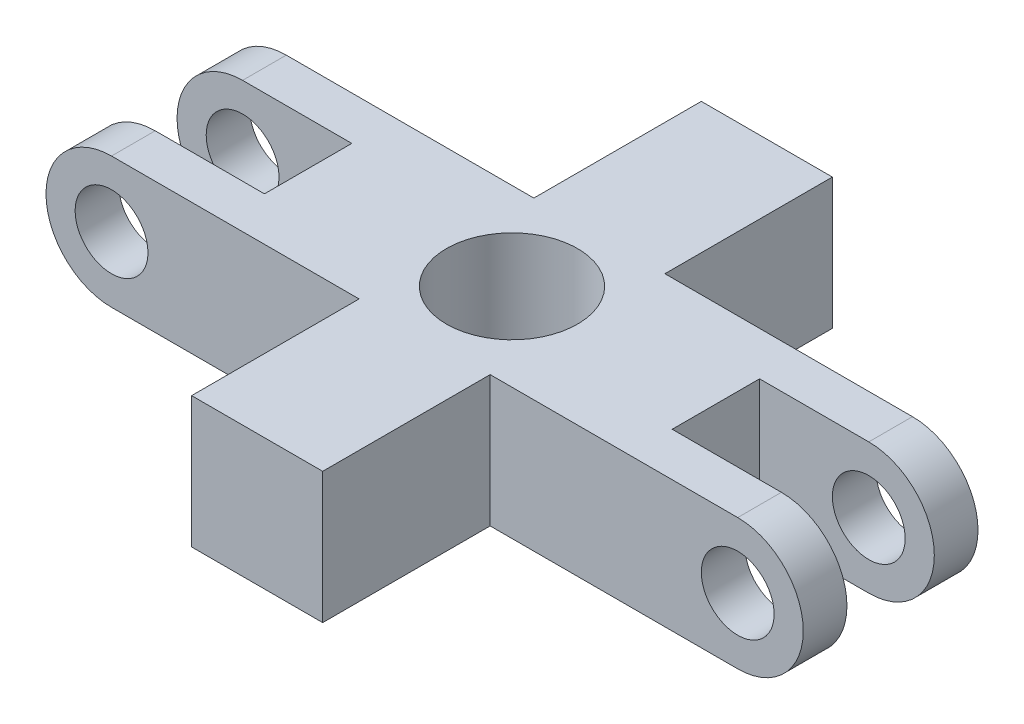
from build123d import *

# Parameters (mm, degrees)
SKETCH1_R           = 4.5
BOSS_EXTRUDE1_DEPTH = 4.5
FILLET2_RADIUS      = 4.5
FILLET2_LENGTH      = 3
FILLET3_RADIUS      = 4.5
FILLET3_LENGTH      = 3
FILLET4_RADIUS      = 4.5
FILLET4_LENGTH      = 3
FILLET5_RADIUS      = 4.5
FILLET5_LENGTH      = 3
SKETCH2_R           = 2.5
CUT_EXTRUDE1_DEPTH  = 34.414068893


with BuildPart() as part:
    # Sketch1 → Boss-Extrude1 (new, symmetric)
    with BuildSketch(Plane(origin=(0, 0, 0), x_dir=(1, 0, 0), z_dir=(0, 1, 0))):
        Polygon((-26, 3), (-14, 3), (-14, -3), (-26, -3), (-26, -6), (-4.5, -6), (-4.5, -17.5), (4.5, -17.5), (4.5, -6), (26, -6), (26, -3), (14, -3), (14, 3), (26, 3), (26, 6), (4.5, 6), (4.5, 17.5), (-4.5, 17.5), (-4.5, 6), (-26, 6), align=None)
        with Locations(Location((0, 0, 0), (0, 0, 270))):
            Circle(SKETCH1_R, mode=Mode.SUBTRACT)
    extrude(amount=BOSS_EXTRUDE1_DEPTH, both=True)

    # Fillet2: full round fillet: the end face becomes a half cylinder, R = half its width
    fillet2_face = Plane((-26, 0, 4.5), x_dir=(0, 0, 1), z_dir=(-1, 0, 0))  # on the end face: x along it, z out of the body
    fillet2_slab = fillet2_face.offset(-FILLET2_RADIUS / 2) * Box(FILLET2_LENGTH, 2 * FILLET2_RADIUS, FILLET2_RADIUS, mode=Mode.PRIVATE)  # the body's end, R deep
    fillet2_round = Plane((-21.5, 0, 4.5), x_dir=(-1, 0, 0), z_dir=(0, 0, 1)) * Cylinder(FILLET2_RADIUS, FILLET2_LENGTH, mode=Mode.PRIVATE)  # its axis R under the face
    add(fillet2_slab - fillet2_round, mode=Mode.SUBTRACT)

    # Fillet3: full round fillet: the end face becomes a half cylinder, R = half its width
    fillet3_face = Plane((-26, 0, -4.5), x_dir=(0, 0, 1), z_dir=(-1, 0, 0))  # on the end face: x along it, z out of the body
    fillet3_slab = fillet3_face.offset(-FILLET3_RADIUS / 2) * Box(FILLET3_LENGTH, 2 * FILLET3_RADIUS, FILLET3_RADIUS, mode=Mode.PRIVATE)  # the body's end, R deep
    fillet3_round = Plane((-21.5, 0, -4.5), x_dir=(-1, 0, 0), z_dir=(0, 0, 1)) * Cylinder(FILLET3_RADIUS, FILLET3_LENGTH, mode=Mode.PRIVATE)  # its axis R under the face
    add(fillet3_slab - fillet3_round, mode=Mode.SUBTRACT)

    # Fillet4: full round fillet: the end face becomes a half cylinder, R = half its width
    fillet4_face = Plane((26, 0, -4.5), x_dir=(0, 0, 1), z_dir=(1, 0, 0))  # on the end face: x along it, z out of the body
    fillet4_slab = fillet4_face.offset(-FILLET4_RADIUS / 2) * Box(FILLET4_LENGTH, 2 * FILLET4_RADIUS, FILLET4_RADIUS, mode=Mode.PRIVATE)  # the body's end, R deep
    fillet4_round = Plane((21.5, 0, -4.5), x_dir=(1, 0, 0), z_dir=(0, 0, 1)) * Cylinder(FILLET4_RADIUS, FILLET4_LENGTH, mode=Mode.PRIVATE)  # its axis R under the face
    add(fillet4_slab - fillet4_round, mode=Mode.SUBTRACT)

    # Fillet5: full round fillet: the end face becomes a half cylinder, R = half its width
    fillet5_face = Plane((26, 0, 4.5), x_dir=(0, 0, -1), z_dir=(1, 0, 0))  # on the end face: x along it, z out of the body
    fillet5_slab = fillet5_face.offset(-FILLET5_RADIUS / 2) * Box(FILLET5_LENGTH, 2 * FILLET5_RADIUS, FILLET5_RADIUS, mode=Mode.PRIVATE)  # the body's end, R deep
    fillet5_round = Plane((21.5, 0, 4.5), x_dir=(1, 0, 0), z_dir=(0, 0, -1)) * Cylinder(FILLET5_RADIUS, FILLET5_LENGTH, mode=Mode.PRIVATE)  # its axis R under the face
    add(fillet5_slab - fillet5_round, mode=Mode.SUBTRACT)

    # Sketch2 → Cut-Extrude1 (cut, symmetric)
    with BuildSketch(Plane.XY.offset(-3)):
        with Locations(Location((-21.5, 0, 0), (0, 0, 180))):
            Circle(SKETCH2_R)
    cut_extrude1 = extrude(amount=CUT_EXTRUDE1_DEPTH, both=True, mode=Mode.SUBTRACT)

    # Mirror1: Cut-Extrude1 across plane
    add(cut_extrude1.mirror(Plane(origin=(0, 0, 0), x_dir=(0, 0, 1), z_dir=(1, 0, 0))), mode=Mode.SUBTRACT)


solid = part.part
